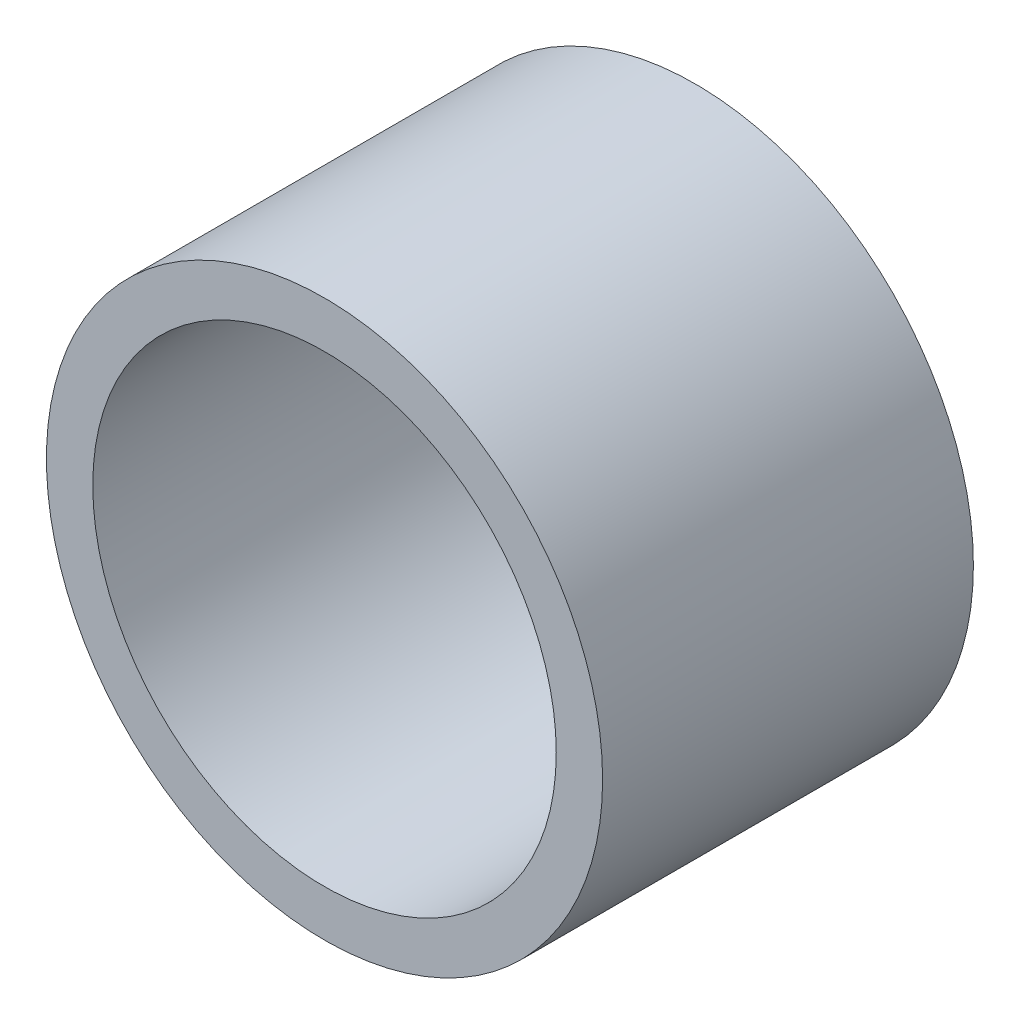
from build123d import *

# Parameters (mm, degrees)
CROQUIS1_R              = 3
CROQUIS1_R_2            = 2.5
SALIENTE_EXTRUIR1_DEPTH = 4


with BuildPart() as part:
    # Croquis1 → Saliente-Extruir1 (new body)
    with BuildSketch(Plane.XY):
        Circle(CROQUIS1_R)
        Circle(CROQUIS1_R_2, mode=Mode.SUBTRACT)
    extrude(amount=SALIENTE_EXTRUIR1_DEPTH)


solid = part.part
